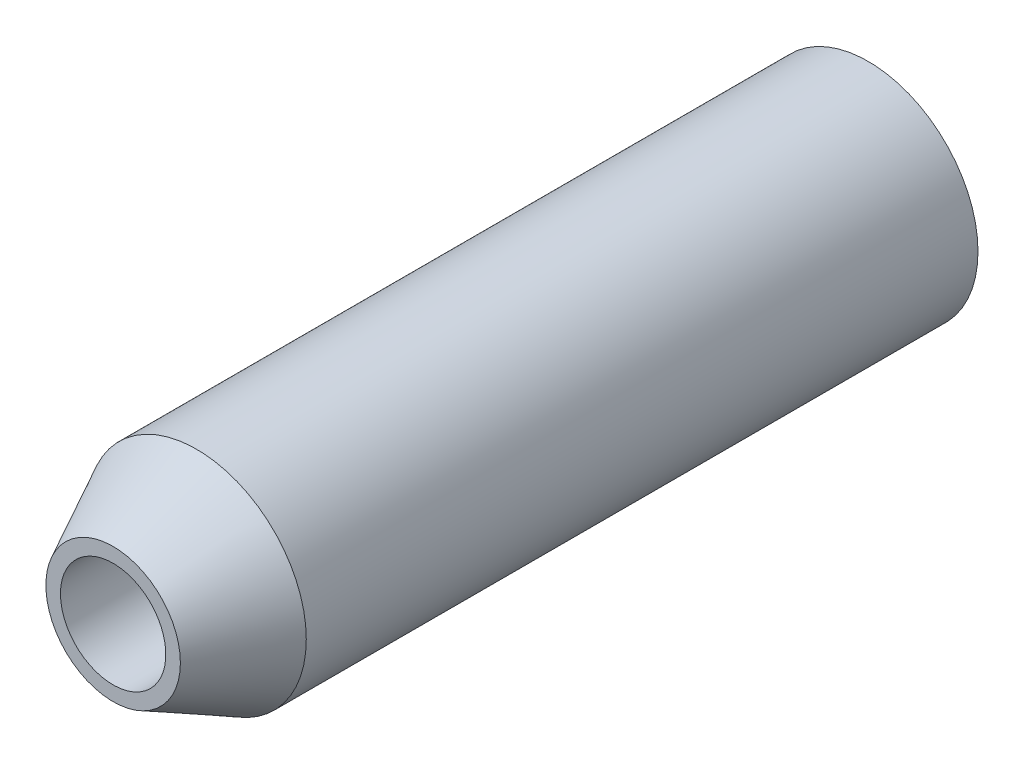
from build123d import *

# Parameters (mm, degrees)
CROQUIS3_R                                           = 3.175
SALIENTE_EXTRUIR2_DEPTH                              = 10.922
REFRENTADO_PARA_TORNILLO_CON_CABEZA_HUEC_D           = 3.048
REFRENTADO_PARA_TORNILLO_CON_CABEZA_HUEC_CBORE_D     = 4.699
REFRENTADO_PARA_TORNILLO_CON_CABEZA_HUEC_CBORE_DEPTH = 17.145
CHAFL_N1_SIZE                                        = 2.413
CHAFL_N1_SIZE2                                       = 1.22948491


with BuildPart() as part:
    # Croquis3 → Saliente-Extruir2 (new, symmetric)
    with BuildSketch(Plane.XY):
        Circle(CROQUIS3_R)
    extrude(amount=SALIENTE_EXTRUIR2_DEPTH, both=True)

    # Refrentado para tornillo con cabeza hueca de 1/41 (through all)
    with Locations(Plane(origin=(0, 0, -10.922), x_dir=(-1, 0, 0), z_dir=(0, 0, -1))):
        with Locations((0, 0)):
            CounterBoreHole(REFRENTADO_PARA_TORNILLO_CON_CABEZA_HUEC_D / 2, REFRENTADO_PARA_TORNILLO_CON_CABEZA_HUEC_CBORE_D / 2, REFRENTADO_PARA_TORNILLO_CON_CABEZA_HUEC_CBORE_DEPTH)

    # Chaflán1
    chafl_n1_edges = [part.edges().sort_by_distance(p)[0] for p in [
        (-3.175, 0, 10.922),
    ]]
    chafl_n1_side = [part.faces().sort_by_distance(p)[0] for p in [
        (-3.175, 0, 0),
    ]]
    chamfer(chafl_n1_edges, length=CHAFL_N1_SIZE, length2=CHAFL_N1_SIZE2, reference=chafl_n1_side[0])


solid = part.part
